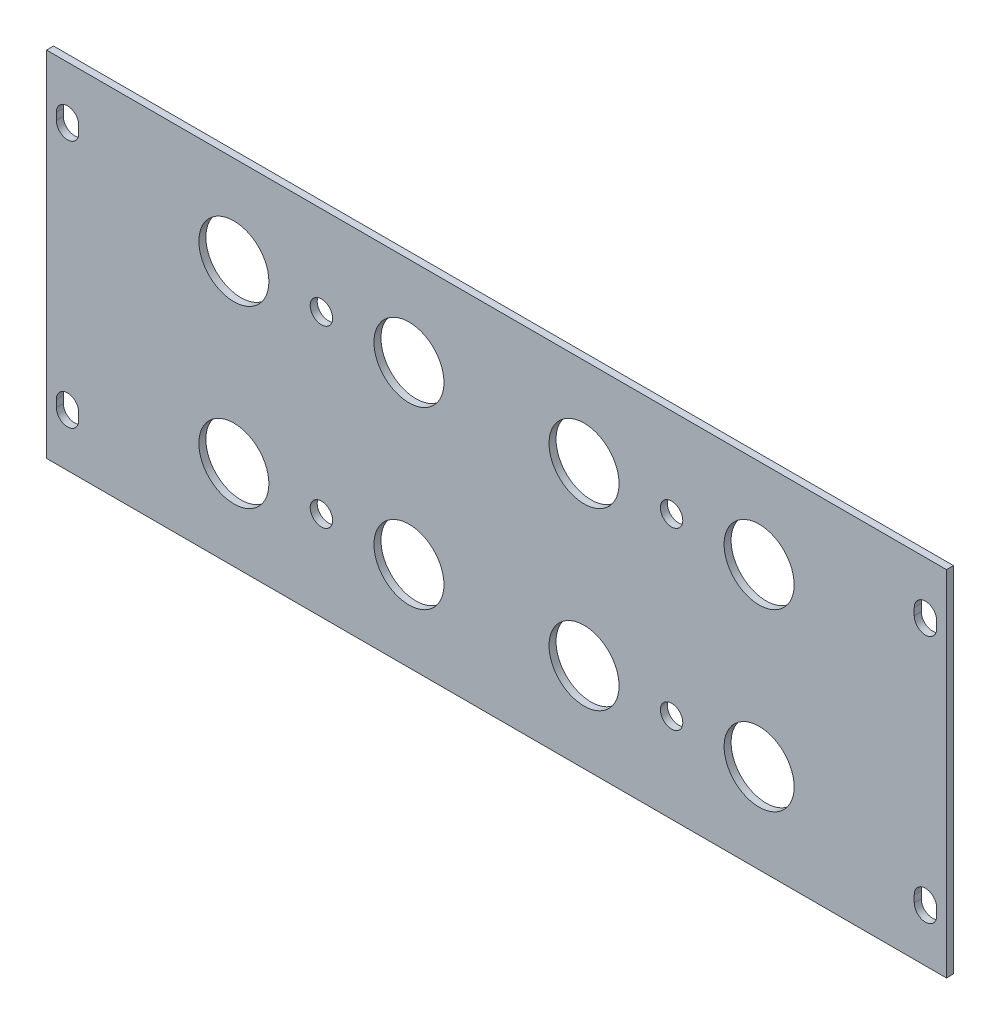
from build123d import *

# Parameters (mm, degrees)
ESQUISSE1_W        = 128.5
ESQUISSE1_H        = 50.5
ESQUISSE1_R        = 1.6
ESQUISSE1_R_2      = 5
BOSS_EXTRU_1_DEPTH = 1


with BuildPart() as part:
    # Esquisse1 → Boss.-Extru.1 (new body)
    with BuildSketch(Plane.XY):
        Rectangle(ESQUISSE1_W, ESQUISSE1_H)
        with Locations((25, 12.5)):
            Circle(ESQUISSE1_R, mode=Mode.SUBTRACT)
        with Locations((-25, 12.5)):
            Circle(ESQUISSE1_R, mode=Mode.SUBTRACT)
        with Locations((-25, -12.5)):
            Circle(ESQUISSE1_R, mode=Mode.SUBTRACT)
        with Locations((25, -12.5)):
            Circle(ESQUISSE1_R, mode=Mode.SUBTRACT)
        with Locations((12.5, -12.5)):
            Circle(ESQUISSE1_R_2, mode=Mode.SUBTRACT)
        with Locations((-37.5, -12.5)):
            Circle(ESQUISSE1_R_2, mode=Mode.SUBTRACT)
        with Locations((-12.5, -12.5)):
            Circle(ESQUISSE1_R_2, mode=Mode.SUBTRACT)
        with Locations((37.5, -12.5)):
            Circle(ESQUISSE1_R_2, mode=Mode.SUBTRACT)
        with Locations((37.5, 12.5)):
            Circle(ESQUISSE1_R_2, mode=Mode.SUBTRACT)
        with Locations((12.5, 12.5)):
            Circle(ESQUISSE1_R_2, mode=Mode.SUBTRACT)
        with Locations((-12.5, 12.5)):
            Circle(ESQUISSE1_R_2, mode=Mode.SUBTRACT)
        with Locations((-37.5, 12.5)):
            Circle(ESQUISSE1_R_2, mode=Mode.SUBTRACT)
        with BuildLine():
            ThreePointArc((62.85, -17.25), (61.25, -15.65), (59.65, -17.25))
            Line((59.65, -17.25), (59.65, -18.25))
            ThreePointArc((59.65, -18.25), (61.25, -19.85), (62.85, -18.25))
            Line((62.85, -18.25), (62.85, -17.25))
        make_face(mode=Mode.SUBTRACT)
        with BuildLine():
            ThreePointArc((59.65, 17.25), (61.25, 15.65), (62.85, 17.25))
            Line((62.85, 17.25), (62.85, 18.25))
            ThreePointArc((62.85, 18.25), (61.25, 19.85), (59.65, 18.25))
            Line((59.65, 18.25), (59.65, 17.25))
        make_face(mode=Mode.SUBTRACT)
        with BuildLine():
            ThreePointArc((-59.65, -17.25), (-61.25, -15.65), (-62.85, -17.25))
            Line((-62.85, -17.25), (-62.85, -18.25))
            ThreePointArc((-62.85, -18.25), (-61.25, -19.85), (-59.65, -18.25))
            Line((-59.65, -18.25), (-59.65, -17.25))
        make_face(mode=Mode.SUBTRACT)
        with BuildLine():
            ThreePointArc((-59.65, 18.25), (-61.25, 19.85), (-62.85, 18.25))
            Line((-62.85, 18.25), (-62.85, 17.25))
            ThreePointArc((-62.85, 17.25), (-61.25, 15.65), (-59.65, 17.25))
            Line((-59.65, 17.25), (-59.65, 18.25))
        make_face(mode=Mode.SUBTRACT)
    extrude(amount=BOSS_EXTRU_1_DEPTH)


solid = part.part
